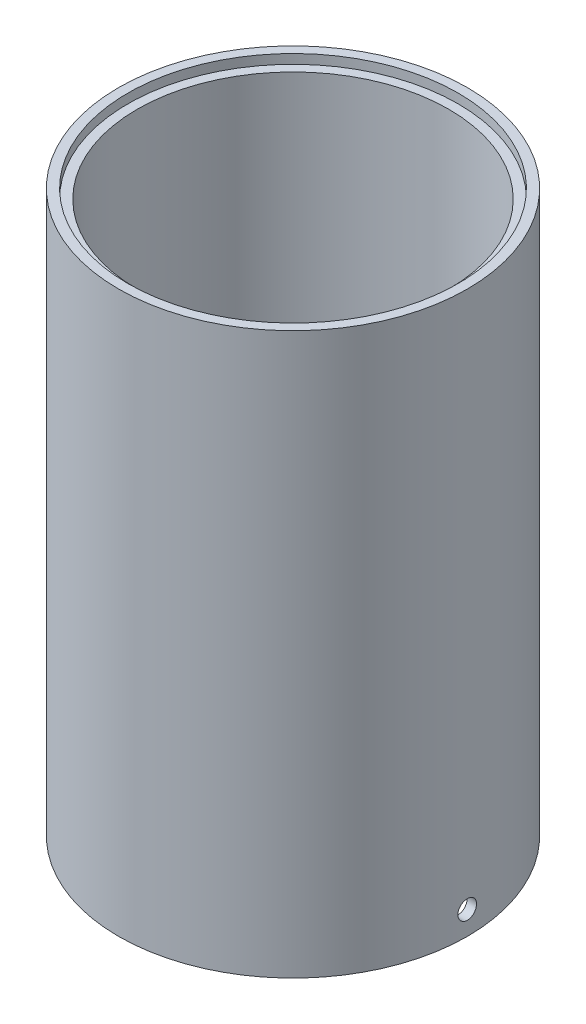
from build123d import *

# Parameters (mm, degrees)
SKETCH1_R               = 56
SKETCH1_R_2             = 50
EXTRUDE_THIN1_DEPTH     = 180
SKETCH2_R               = 53
CUT_EXTRUDE1_DEPTH      = 3
CUT_EXTRUDE2_START      = -15
SKETCH3_R               = 53
CUT_EXTRUDE2_DEPTH      = 15
CUT_EXTRUDE3_DEPTH      = 218.754448864
CUT_EXTRUDE3_DEPTH_BACK = 218.754448864
SKETCH5_R               = 3


with BuildPart() as part:
    # Sketch1 → Extrude-Thin1 (new body)
    with BuildSketch(Plane(origin=(0, 0, 0), x_dir=(1, 0, 0), z_dir=(0, 1, 0))):
        Circle(SKETCH1_R)
        Circle(SKETCH1_R_2, mode=Mode.SUBTRACT)
    extrude(amount=EXTRUDE_THIN1_DEPTH)

    # Sketch2 → Cut-Extrude1 (cut)
    with BuildSketch(Plane(origin=(0, 180, 0), x_dir=(1, 0, 0), z_dir=(0, 1, 0))):
        with Locations(Location((0, 0, 0), (0, 0, 270))):
            Circle(SKETCH2_R)
    extrude(amount=-CUT_EXTRUDE1_DEPTH, mode=Mode.SUBTRACT)

    # Sketch3 → Cut-Extrude2 (cut)
    with BuildSketch(Plane.XZ.offset(CUT_EXTRUDE2_START)):
        with Locations(Location((0, 0, 0), (0, 0, 90))):
            Circle(SKETCH3_R)
    extrude(amount=CUT_EXTRUDE2_DEPTH, mode=Mode.SUBTRACT)

    # Sketch5 → Cut-Extrude3 (cut, two sides: drawn at the far end of the back side and taken through both)
    with BuildSketch(Plane.ZY.offset(-53).offset(-CUT_EXTRUDE3_DEPTH_BACK)):
        with Locations(Location((0, 7.5, 0), (0, 0, 180))):
            Circle(SKETCH5_R)
    extrude(amount=CUT_EXTRUDE3_DEPTH + CUT_EXTRUDE3_DEPTH_BACK, mode=Mode.SUBTRACT)


solid = part.part
